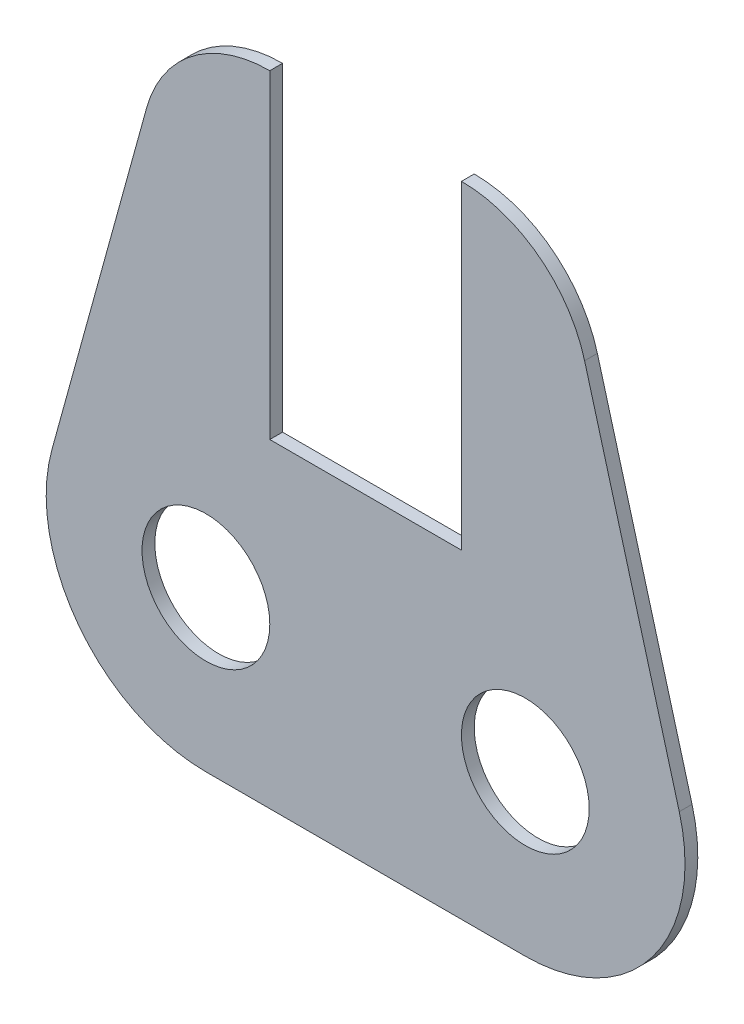
from build123d import *

# Parameters (mm, degrees)
IZIM2_R                     = 10
Y_KSEKLIK_EKSTR_ZYON1_DEPTH = 2


with BuildPart() as part:
    # Çizim2 → Yükseklik-Ekstrüzyon1 (new body)
    with BuildSketch(Plane.XY):
        with BuildLine():
            Line((-15, 100), (-15, 50))
            Line((-15, 50), (15, 50))
            Line((15, 50), (15, 100))
            ThreePointArc((15, 100), (27.116614772, 95.911871243), (34.279801416, 85.318764647))
            Line((34.279801416, 85.318764647), (49.09975177, 31.59845198))
            ThreePointArc((49.09975177, 31.59845198), (44.889839054, 9.804227706), (25, -0.050003828))
            Line((25, -0.050003828), (-25, -0.050003828))
            ThreePointArc((-25, -0.050003828), (-44.889839054, 9.804227706), (-49.09975177, 31.59845198))
            Line((-49.09975177, 31.59845198), (-34.279801416, 85.318764647))
            ThreePointArc((-34.279801416, 85.318764647), (-27.116614772, 95.911871243), (-15, 100))
        make_face()
        with Locations((-25, 24.949996172)):
            Circle(IZIM2_R, mode=Mode.SUBTRACT)
        with Locations((25, 24.949996172)):
            Circle(IZIM2_R, mode=Mode.SUBTRACT)
    extrude(amount=Y_KSEKLIK_EKSTR_ZYON1_DEPTH)


solid = part.part
